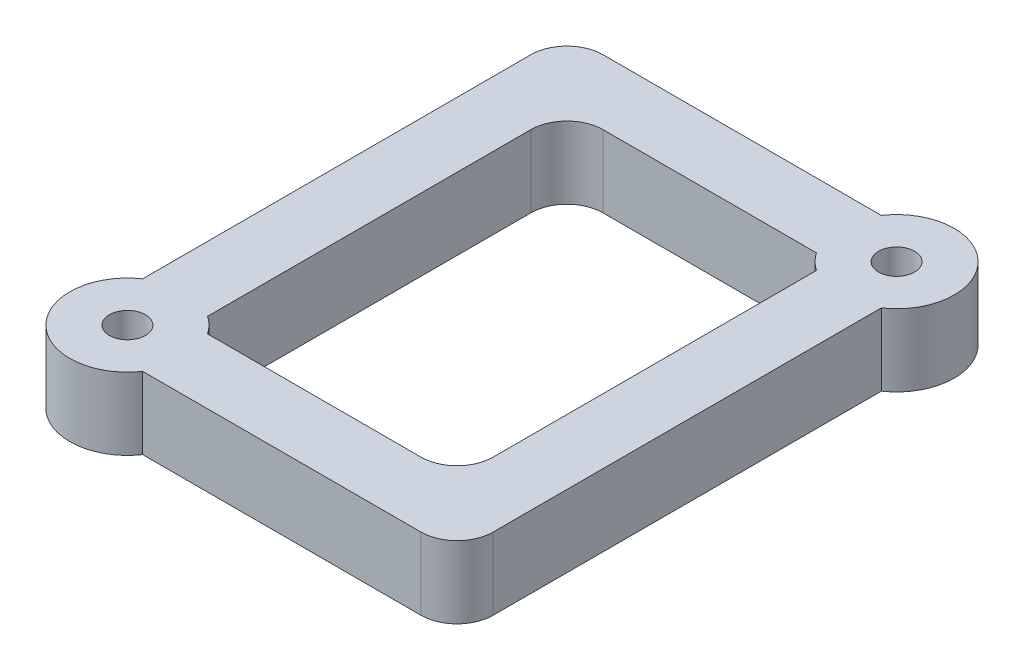
from build123d import *

# Parameters (mm, degrees)
CROQUIS1_R              = 4
CROQUIS1_R_2            = 1.25
SALIENTE_EXTRUIR1_DEPTH = 2.5
REDONDEO1_R             = 2.5


with BuildPart() as part:
    # Croquis1 → Saliente-Extruir1 (new, symmetric)
    # profile 1 of 4: a face of its own
    with BuildSketch(Plane(origin=(0, 0, 0), x_dir=(1, 0, 0), z_dir=(0, 1, 0))):
        with BuildLine():
            Line((-13.68, 17.49), (-13.68, -11.932810861))
            ThreePointArc((-13.68, -11.932810861), (-11.43, -11.24), (-9.18, -11.932810861))
            Line((-9.18, -11.932810861), (-9.18, 12.99))
            Line((-9.18, 12.99), (8.122810861, 12.99))
            ThreePointArc((8.122810861, 12.99), (7.43, 15.24), (8.122810861, 17.49))
            Line((8.122810861, 17.49), (-13.68, 17.49))
        make_face()
    # profile 2 of 4: a face of its own
    with BuildSketch(Plane(origin=(0, 0, 0), x_dir=(1, 0, 0), z_dir=(0, 1, 0))):
        with BuildLine():
            ThreePointArc((-7.43, -15.24), (-7.607124344, -16.417124344), (-8.122810861, -17.49))
            Line((-8.122810861, -17.49), (13.68, -17.49))
            Line((13.68, -17.49), (13.68, 11.932810861))
            ThreePointArc((13.68, 11.932810861), (11.43, 11.24), (9.18, 11.932810861))
            Line((9.18, 11.932810861), (9.18, -12.99))
            Line((9.18, -12.99), (-8.122810861, -12.99))
            ThreePointArc((-8.122810861, -12.99), (-7.607124344, -14.062875656), (-7.43, -15.24))
        make_face()
    # profile 3 of 4: a face of its own
    with BuildSketch(Plane(origin=(0, 0, 0), x_dir=(1, 0, 0), z_dir=(0, 1, 0))):
        with Locations((11.43, 15.24)):
            Circle(CROQUIS1_R)
        with Locations(Location((11.43, 15.24, 0), (0, 0, 270))):
            Circle(CROQUIS1_R_2, mode=Mode.SUBTRACT)
    # profile 4 of 4: a face of its own
    with BuildSketch(Plane(origin=(0, 0, 0), x_dir=(1, 0, 0), z_dir=(0, 1, 0))):
        with Locations((-11.43, -15.24)):
            Circle(CROQUIS1_R)
        with Locations(Location((-11.43, -15.24, 0), (0, 0, 270))):
            Circle(CROQUIS1_R_2, mode=Mode.SUBTRACT)
    extrude(amount=SALIENTE_EXTRUIR1_DEPTH, both=True)

    # Redondeo1
    redondeo1_edges = [part.edges().sort_by_distance(p)[0] for p in [
        (-9.18, 0, -12.99),
        (9.18, 0, 12.99),
        (13.68, 0, 17.49),
        (-13.68, 0, -17.49),
    ]]
    fillet(redondeo1_edges, radius=REDONDEO1_R)


solid = part.part
